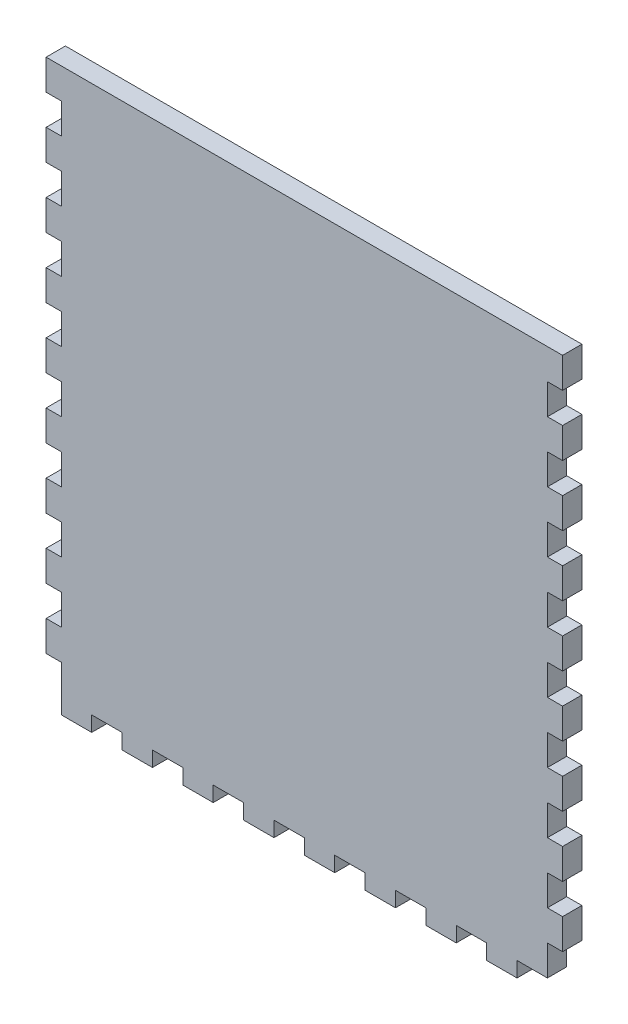
from build123d import *

# Parameters (mm, degrees)
SKETCH1_W           = 80
SKETCH1_H           = 90
BOSS_EXTRUDE1_DEPTH = 3.175
SKETCH2_W           = 5
SKETCH2_H           = 3.175
BOSS_EXTRUDE2_DEPTH = 2.5
SKETCH3_W           = 3.175
SKETCH3_H           = 5
BOSS_EXTRUDE3_DEPTH = 2.5
SKETCH4_W           = 3.175
SKETCH4_H           = 5
BOSS_EXTRUDE4_DEPTH = 2.5
LPATTERN1_COUNT     = 9
LPATTERN1_PITCH     = 10
LPATTERN2_COUNT     = 8
LPATTERN2_PITCH     = 10
LPATTERN3_COUNT     = 9
LPATTERN3_PITCH     = 10


with BuildPart() as part:
    # Sketch1 → Boss-Extrude1 (new body)
    with BuildSketch(Plane.XY):
        with Locations((40, 45)):
            Rectangle(SKETCH1_W, SKETCH1_H)
    extrude(amount=BOSS_EXTRUDE1_DEPTH)

    # Sketch2 → Boss-Extrude2 (add)
    with BuildSketch(Plane.XZ):
        with Locations((2.5, 1.5875)):
            Rectangle(SKETCH2_W, SKETCH2_H)
    boss_extrude2 = extrude(amount=BOSS_EXTRUDE2_DEPTH)

    # Sketch3 → Boss-Extrude3 (add)
    with BuildSketch(Plane(origin=(80, 0, 0), x_dir=(0, 0, -1), z_dir=(1, 0, 0))):
        with Locations((-1.5875, 87.5)):
            Rectangle(SKETCH3_W, SKETCH3_H)
    boss_extrude3 = extrude(amount=BOSS_EXTRUDE3_DEPTH)

    # Sketch4 → Boss-Extrude4 (add)
    with BuildSketch(Plane.ZY):
        with Locations((1.5875, 87.5)):
            Rectangle(SKETCH4_W, SKETCH4_H)
    boss_extrude4 = extrude(amount=BOSS_EXTRUDE4_DEPTH)

    # LPattern1: Boss-Extrude4 ×9
    with Locations(*[(0, -i * LPATTERN1_PITCH, 0) for i in range(1, LPATTERN1_COUNT)]):
        add(boss_extrude4)

    # LPattern2: Boss-Extrude2 ×8
    with Locations(*[(i * LPATTERN2_PITCH, 0, 0) for i in range(1, LPATTERN2_COUNT)]):
        add(boss_extrude2)

    # LPattern3: Boss-Extrude3 ×9
    with Locations(*[(0, -i * LPATTERN3_PITCH, 0) for i in range(1, LPATTERN3_COUNT)]):
        add(boss_extrude3)


solid = part.part
